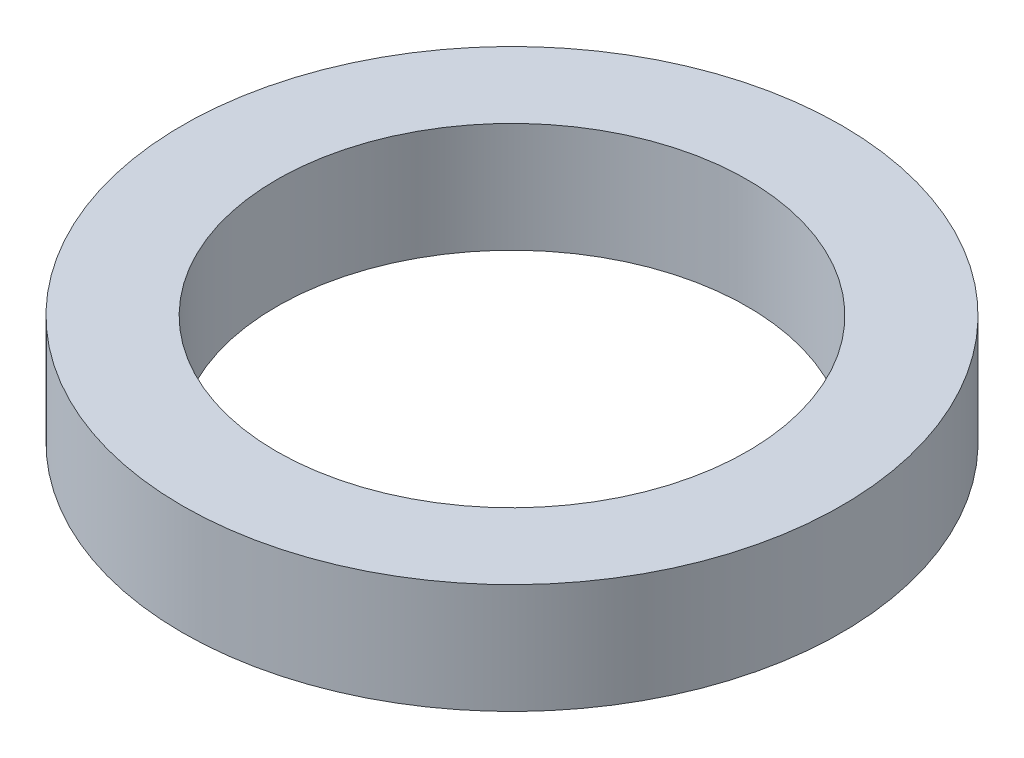
from build123d import *

# Parameters (mm, degrees)
SKETCH1_R           = 533.4
SKETCH1_R_2         = 381
BOSS_EXTRUDE1_DEPTH = 177.8


with BuildPart() as part:
    # Sketch1 → Boss-Extrude1 (new body)
    with BuildSketch(Plane(origin=(0, 0, 0), x_dir=(1, 0, 0), z_dir=(0, 1, 0))):
        with Locations(Location((0, 0, 0), (0, 0, 270))):
            Circle(SKETCH1_R)
        with Locations(Location((0, 0, 0), (0, 0, 270))):
            Circle(SKETCH1_R_2, mode=Mode.SUBTRACT)
    extrude(amount=BOSS_EXTRUDE1_DEPTH)


solid = part.part
